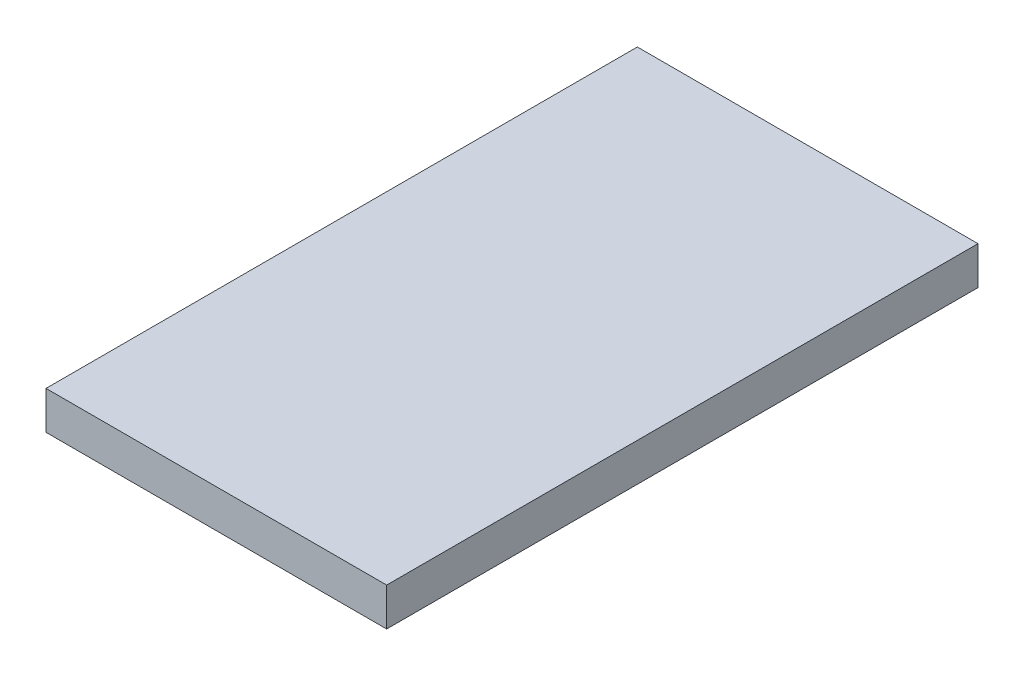
from build123d import *

# Parameters (mm, degrees)
SKETCH2_W           = 17.894316584
SKETCH2_H           = 31.06183256
BOSS_EXTRUDE1_DEPTH = 2


with BuildPart() as part:
    # Sketch2 → Boss-Extrude1 (new body)
    with BuildSketch(Plane(origin=(0, 0, 0), x_dir=(1, 0, 0), z_dir=(0, 1, 0))):
        Rectangle(SKETCH2_W, SKETCH2_H)
    extrude(amount=BOSS_EXTRUDE1_DEPTH)


solid = part.part
